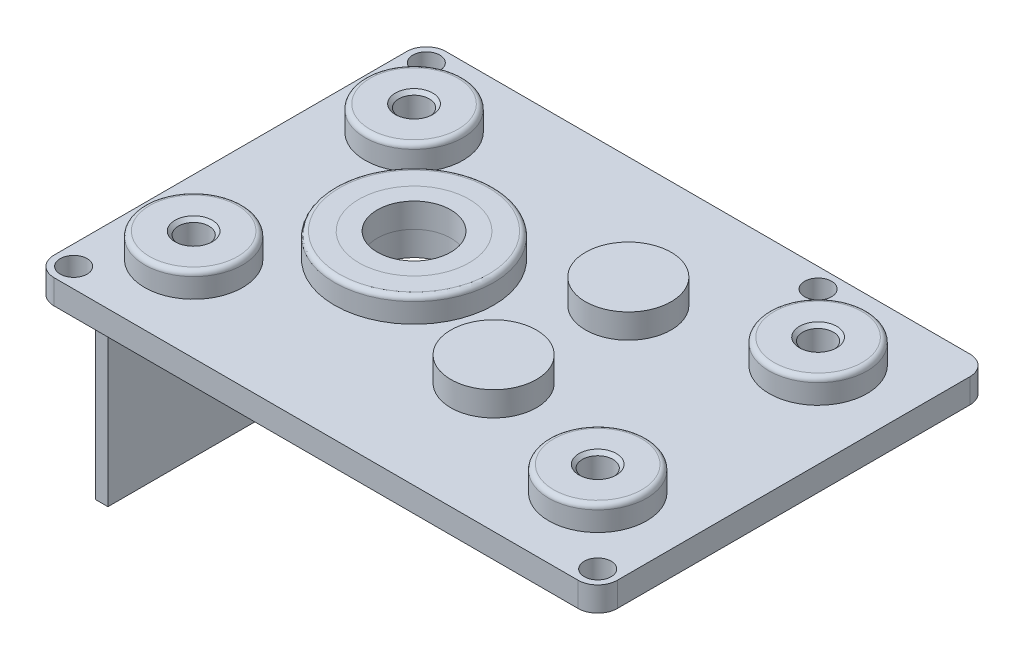
from build123d import *

# Parameters (mm, degrees)
SKETCH2_W                     = 46
SKETCH2_H                     = 32
BOSS_EXTRUDE2_DEPTH           = 2
SKETCH6_R                     = 3
CUT_EXTRUDE1_DEPTH            = 35.942810419
SKETCH7_R                     = 4.5
SKETCH7_R_2                   = 3
BOSS_EXTRUDE4_DEPTH           = 2
SKETCH8_R                     = 6.5
SKETCH8_R_2                   = 4.5
BOSS_EXTRUDE5_DEPTH           = 2
SKETCH3_R                     = 4
BOSS_EXTRUDE3_DEPTH           = 2
FILLET3_R                     = 0.4
LPATTERN1_COUNT               = 2
LPATTERN1_PITCH               = 33
SKETCH9_R                     = 3.5
BOSS_EXTRUDE6_DEPTH           = 2
MIRROR2_COPY_1_SKETCH_R       = 4
MIRROR2_COPY_1_DEPTH          = 2
SKETCH10_W                    = 1.1
SKETCH10_H                    = 2
M2_CLEARANCE_HOLE1_AT_2_COUNT = 2
M2_CLEARANCE_HOLE1_AT_2_PITCH = 32
M2_CLEARANCE_HOLE1_AT_3_COUNT = 2
M2_CLEARANCE_HOLE1_AT_3_PITCH = 51.587595408
M2_CLEARANCE_HOLE1_AT_4_COUNT = 2
M2_CLEARANCE_HOLE1_AT_4_PITCH = 28.8
FILLET1_R                     = 1.6
SKETCH12_W                    = 1
SKETCH12_H                    = 22
BOSS_EXTRUDE7_DEPTH           = 17
FILLET5_R                     = 0.4


with BuildPart() as part:
    # Sketch2 → Boss-Extrude2 (new body)
    with BuildSketch(Plane(origin=(0, 0, 0), x_dir=(1, 0, 0), z_dir=(0, 1, 0))):
        with Locations((8, 0)):
            Rectangle(SKETCH2_W, SKETCH2_H)
    extrude(amount=BOSS_EXTRUDE2_DEPTH)

    # Sketch6 → Cut-Extrude1 (cut, through all)
    with BuildSketch(Plane(origin=(0, 2, 0), x_dir=(1, 0, 0), z_dir=(0, 1, 0))):
        with Locations(Location((0, 0, 0), (0, 0, 270))):
            Circle(SKETCH6_R)
    extrude(amount=-CUT_EXTRUDE1_DEPTH, mode=Mode.SUBTRACT)

    # Sketch3 → Boss-Extrude3 (add)
    with BuildSketch(Plane(origin=(0, 2, 0), x_dir=(1, 0, 0), z_dir=(0, 1, 0))):
        with Locations(Location((-9, 9, 0), (0, 0, 270))):
            Circle(SKETCH3_R)
    boss_extrude3 = extrude(amount=BOSS_EXTRUDE3_DEPTH)

    # Sketch4 → M3x0.5 Tapped Hole1 (revolve, cut)
    with BuildSketch(Plane(origin=(-9, 4, -9), x_dir=(0, 0, 1), z_dir=(1, 0, 0))):
        Polygon((0, 0), (0, 4), (1.25, 4), (1.25, 0.275), (1.525, 0), align=None)
    m3x0_5_tapped_hole1 = revolve(axis=Axis((-9, 10.35, -9), (0, -1, 0)), mode=Mode.SUBTRACT)

    # LPattern1: Boss-Extrude3, M3x0.5 Tapped Hole1 ×2
    with Locations(*[(i * LPATTERN1_PITCH, 0, 0) for i in range(1, LPATTERN1_COUNT)]):
        add(boss_extrude3)
        add(m3x0_5_tapped_hole1, mode=Mode.SUBTRACT)

    # Sketch9 → Boss-Extrude6 (add)
    with BuildSketch(Plane(origin=(0, 2, 0), x_dir=(1, 0, 0), z_dir=(0, 1, 0))):
        with Locations(Location((12, 5.5, 0), (0, 0, 270))):
            Circle(SKETCH9_R)
    boss_extrude6 = extrude(amount=BOSS_EXTRUDE6_DEPTH)

    # Mirror2: Boss-Extrude3, M3x0.5 Tapped Hole1 across plane
    add(boss_extrude3.mirror(Plane.XY))
    add(m3x0_5_tapped_hole1.mirror(Plane.XY), mode=Mode.SUBTRACT)

    # Mirror2 copy 1 sketch → Mirror2 copy 1 (add)
    with BuildSketch(Plane(origin=(33, 2, 0), x_dir=(1, 0, 0), z_dir=(0, 1, 0))):
        with Locations((-9, -9)):
            Circle(MIRROR2_COPY_1_SKETCH_R)
    extrude(amount=MIRROR2_COPY_1_DEPTH)

    # Mirror2 copy 2 sketch → Mirror2 copy 2 (revolve, cut)
    with BuildSketch(Plane(origin=(24, 4, 9), x_dir=(0, 0, -1), z_dir=(1, 0, 0))):
        Polygon((0, 0), (0, -4), (1.25, -4), (1.25, -0.275), (1.525, 0), align=None)
    revolve(axis=Axis((24, 10.35, 9), (0, 1, 0)), mode=Mode.SUBTRACT)

    # Mirror3: Boss-Extrude6 across plane
    add(boss_extrude6.mirror(Plane.XY))

    # Sketch10 → M2 Clearance Hole1 (revolve, cut)
    with BuildSketch(Plane(origin=(-13.4, 2, -14.4), x_dir=(0, 0, 1), z_dir=(1, 0, 0))):
        with Locations((0.55, 1)):
            Rectangle(SKETCH10_W, SKETCH10_H)
    m2_clearance_hole1 = revolve(axis=Axis((-13.4, 8.35, -14.4), (0, -1, 0)), mode=Mode.SUBTRACT)

    # M2 Clearance Hole1 at 2: M2 Clearance Hole1 ×2
    with Locations(*[(i * M2_CLEARANCE_HOLE1_AT_2_PITCH, 0, 0) for i in range(1, M2_CLEARANCE_HOLE1_AT_2_COUNT)]):
        add(m2_clearance_hole1, mode=Mode.SUBTRACT)

    # M2 Clearance Hole1 at 3: M2 Clearance Hole1 ×2
    with Locations(*[Vector(0.8296568130639779, 0, 0.5582737433701533) * (i * M2_CLEARANCE_HOLE1_AT_3_PITCH) for i in range(1, M2_CLEARANCE_HOLE1_AT_3_COUNT)]):
        add(m2_clearance_hole1, mode=Mode.SUBTRACT)

    # M2 Clearance Hole1 at 4: M2 Clearance Hole1 ×2
    with Locations(*[(0, 0, i * M2_CLEARANCE_HOLE1_AT_4_PITCH) for i in range(1, M2_CLEARANCE_HOLE1_AT_4_COUNT)]):
        add(m2_clearance_hole1, mode=Mode.SUBTRACT)

    # Fillet1
    fillet1_edges = [part.edges().sort_by_distance(p)[0] for p in [
        (-15, 1, -16),
        (31, 1, -16),
        (31, 1, 16),
        (-15, 1, 16),
    ]]
    fillet(fillet1_edges, radius=FILLET1_R)

    # Sketch12 → Boss-Extrude7 (add)
    with BuildSketch(Plane.XZ):
        with Locations((-14.5, 0)):
            Rectangle(SKETCH12_W, SKETCH12_H)
    extrude(amount=BOSS_EXTRUDE7_DEPTH)

    # Fillet5
    fillet5_edges = [part.edges().sort_by_distance(p)[0] for p in [
        (-9, 4, -13),
        (24, 4, -13),
        (-9, 4, 13),
        (20, 4, 9),
    ]]
    fillet(fillet5_edges, radius=FILLET5_R)


with BuildPart() as body_2:
    # Sketch7 → Boss-Extrude4 (new body)
    with BuildSketch(Plane(origin=(0, 2, 0), x_dir=(1, 0, 0), z_dir=(0, 1, 0))):
        with Locations(Location((0, 0, 0), (0, 0, 270))):
            Circle(SKETCH7_R)
        with Locations(Location((0, 0, 0), (0, 0, 270))):
            Circle(SKETCH7_R_2, mode=Mode.SUBTRACT)
    extrude(amount=BOSS_EXTRUDE4_DEPTH)


with BuildPart() as body_3:
    # Sketch8 → Boss-Extrude5 (new body)
    with BuildSketch(Plane(origin=(0, 2, 0), x_dir=(1, 0, 0), z_dir=(0, 1, 0))):
        with Locations(Location((0, 0, 0), (0, 0, 270))):
            Circle(SKETCH8_R)
        with Locations(Location((0, 0, 0), (0, 0, 270))):
            Circle(SKETCH8_R_2, mode=Mode.SUBTRACT)
    extrude(amount=BOSS_EXTRUDE5_DEPTH)

    # Fillet3
    fillet3_edges = [body_3.edges().sort_by_distance(p)[0] for p in [
        (0, 4, -6.5),
    ]]
    fillet(fillet3_edges, radius=FILLET3_R)


solid = Compound([part.part, body_2.part, body_3.part])
